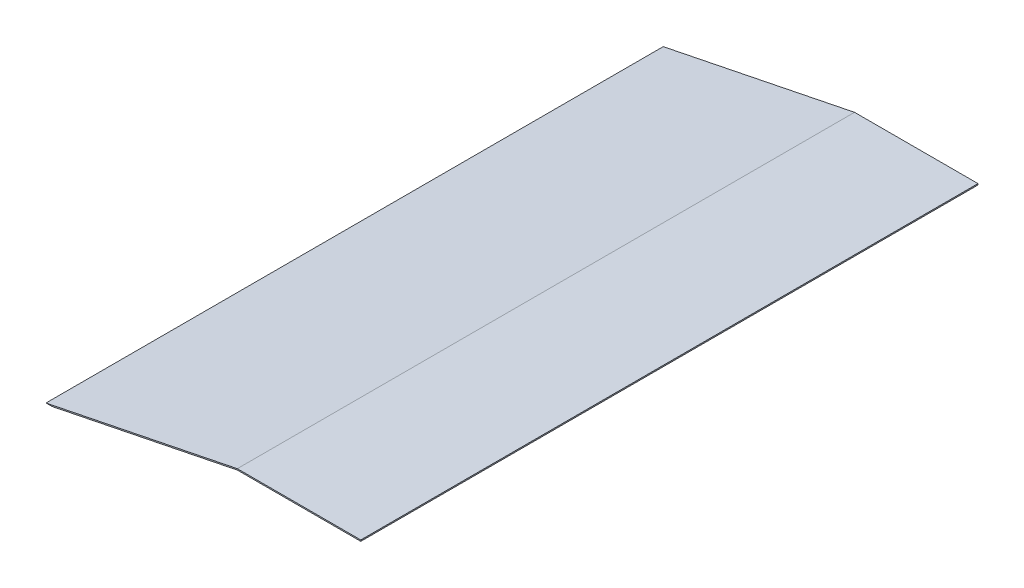
from build123d import *

# Parameters (mm, degrees)
EXTRUDE_1_DEPTH = 100


with BuildPart() as part:
    # 草图1 → 凸台-拉伸1 (new body)
    with BuildSketch(Plane.XY):
        Polygon((-50, 0), (-20, 6.081301065), (0, 6.081301065), (0, 6.284011101), (-20, 6.284011101), (-51, 0), align=None)
    extrude(amount=EXTRUDE_1_DEPTH)


solid = part.part
